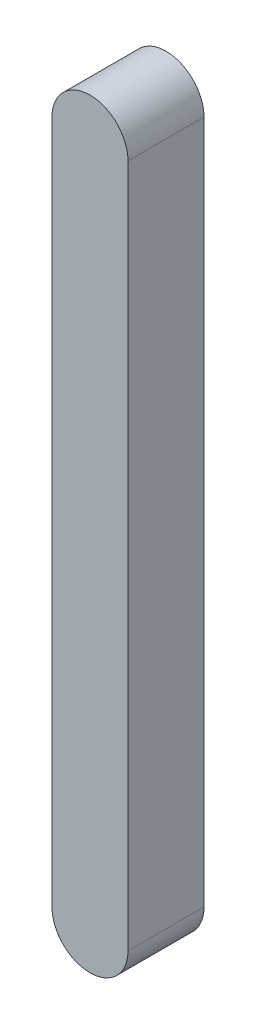
from build123d import *

# Parameters (mm, degrees)
ESQUISSE1_W        = 25
ESQUISSE1_H        = 25
BOSS_EXTRU_1_DEPTH = 225
BOSS_EXTRU_2_DEPTH = 25
BOSS_EXTRU_3_DEPTH = 25


with BuildPart() as part:
    # Esquisse1 → Boss.-Extru.1 (new body)
    with BuildSketch(Plane(origin=(0, 0, 0), x_dir=(1, 0, 0), z_dir=(0, 1, 0))):
        Rectangle(ESQUISSE1_W, ESQUISSE1_H)
    extrude(amount=BOSS_EXTRU_1_DEPTH)

    # Esquisse2 → Boss.-Extru.2 (add)
    with BuildSketch(Plane.XY.offset(12.5)):
        with BuildLine():
            Line((-12.5, 225), (12.5, 225))
            ThreePointArc((12.5, 225), (0, 237.5), (-12.5, 225))
        make_face()
    extrude(amount=-BOSS_EXTRU_2_DEPTH)

    # Esquisse3 → Boss.-Extru.3 (add)
    with BuildSketch(Plane.XY.offset(12.5)):
        with BuildLine():
            Line((-12.5, 0), (12.5, 0))
            ThreePointArc((12.5, 0), (0, -12.5), (-12.5, 0))
        make_face()
    extrude(amount=-BOSS_EXTRU_3_DEPTH)


solid = part.part
